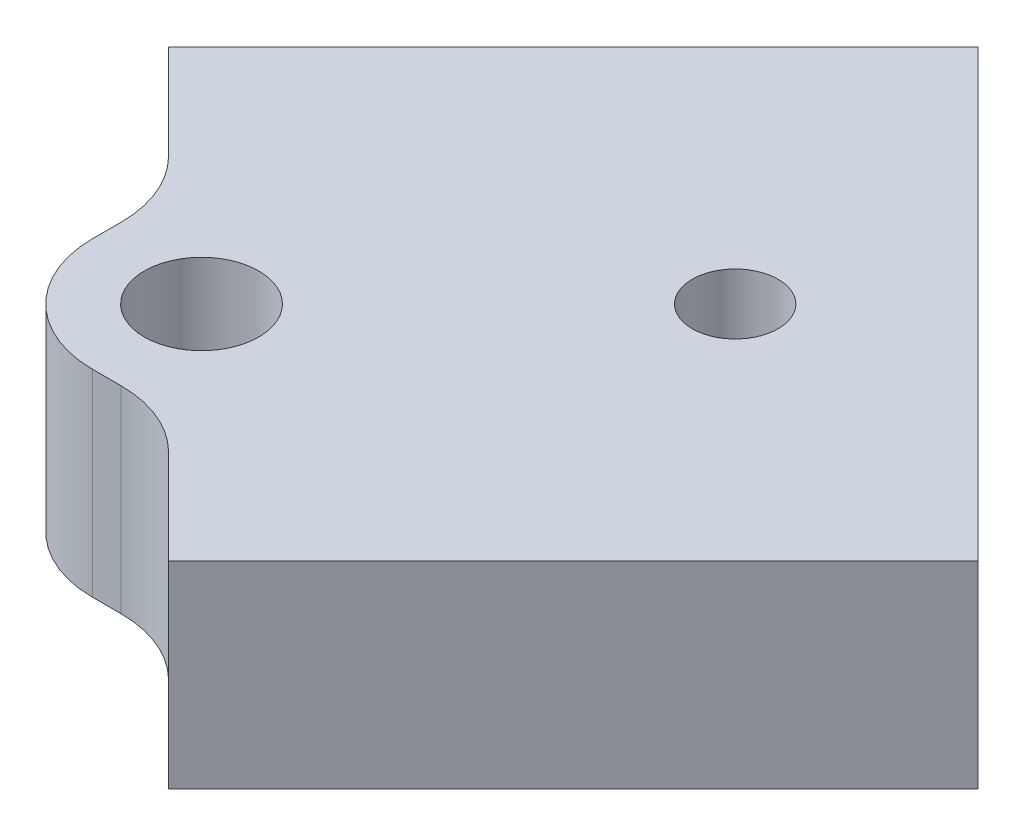
from build123d import *

# Parameters (mm, degrees)
AUFSATZ_LINEAR_AUSTRAGEN1_DEPTH = 6.9
F_4_0_4_DURCHMESSER_BOHRUNG1_D  = 4
F_3_0_3_DURCHMESSER_BOHRUNG1_D  = 3


with BuildPart() as part:
    # Skizze1 → Aufsatz-Linear austragen1 (new body)
    with BuildSketch(Plane(origin=(0, 0, 0), x_dir=(1, 0, 0), z_dir=(0, 1, 0))):
        with BuildLine():
            Line((0, -3.95), (1, -3.95))
            ThreePointArc((1, -3.95), (2.530733729, -4.25448187), (3.828427125, -5.121572875))
            Line((3.828427125, -5.121572875), (7.131601718, -8.424747468))
            Line((7.131601718, -8.424747468), (21.273737342, 5.717388155))
            Line((21.273737342, 5.717388155), (5.717388155, 21.273737342))
            Line((5.717388155, 21.273737342), (-8.424747468, 7.131601718))
            Line((-8.424747468, 7.131601718), (-5.121572875, 3.828427125))
            ThreePointArc((-5.121572875, 3.828427125), (-4.25448187, 2.530733729), (-3.95, 1))
            Line((-3.95, 1), (-3.95, 0))
            ThreePointArc((-3.95, 0), (-2.793071786, -2.793071786), (0, -3.95))
        make_face()
    extrude(amount=AUFSATZ_LINEAR_AUSTRAGEN1_DEPTH)

    # Ø4.0 (4) Durchmesser Bohrung1 (through all)
    with Locations(Plane(origin=(0, 6.9, 0), x_dir=(1, 0, 0), z_dir=(0, 1, 0))):
        with Locations((-0.070710678, -0.070710678)):
            Hole(F_4_0_4_DURCHMESSER_BOHRUNG1_D / 2)

    # Ø3.0 (3) Durchmesser Bohrung1 (through all)
    with Locations(Plane(origin=(0, 6.9, 0), x_dir=(1, 0, 0), z_dir=(0, 1, 0))):
        with Locations((9.252922061, 9.252922061)):
            Hole(F_3_0_3_DURCHMESSER_BOHRUNG1_D / 2)


solid = part.part
